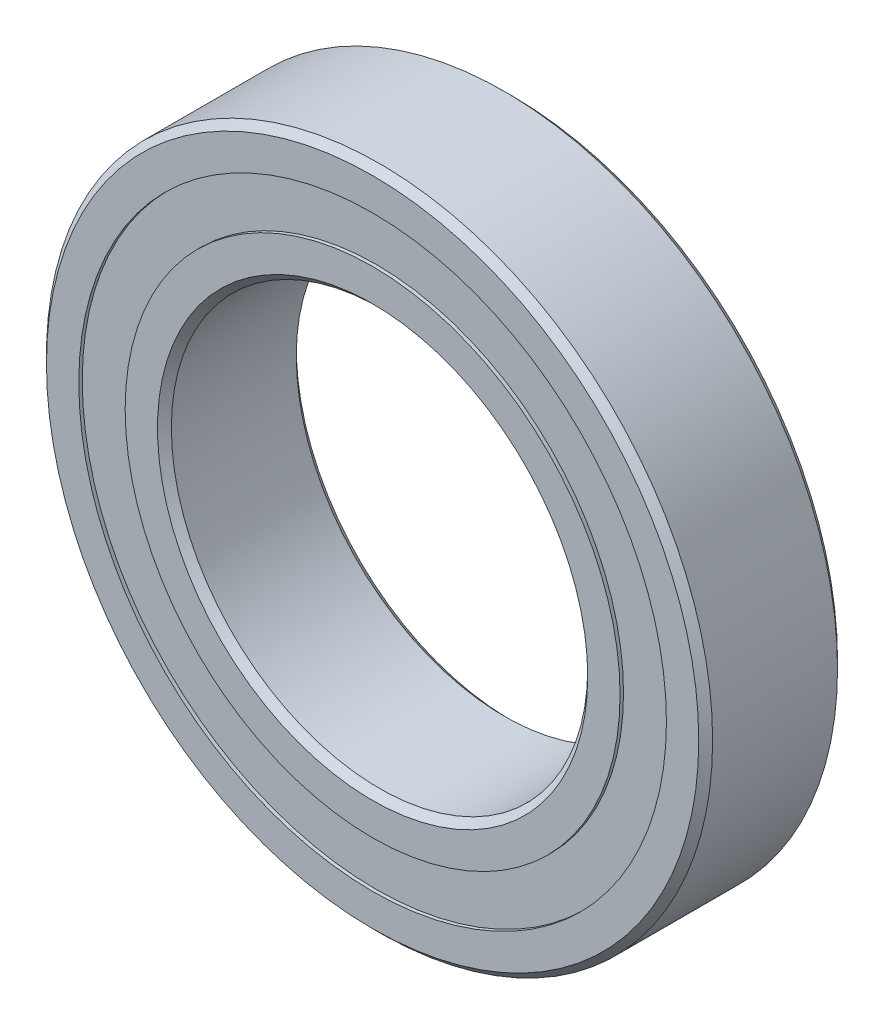
from build123d import *

# Parameters (mm, degrees)
CIRPATTERN1_COUNT = 12
SKETCH5_W         = 0.985011438
SKETCH5_H         = 1.67032967


with BuildPart() as part:
    # Sketch1 → Revolve1 (revolve)
    with BuildSketch(Plane(origin=(0, 0, 0), x_dir=(0, 0, -1), z_dir=(1, 0, 0))):
        with BuildLine():
            Line((2.25, 12), (-2.25, 12))
            Line((-2.25, 12), (-2.5, 11.75))
            Line((-2.5, 11.75), (-2.5, 10.585164835))
            Line((-2.5, 10.585164835), (-1.111111111, 10.585164835))
            ThreePointArc((-1.111111111, 10.585164835), (0, 11.139988562), (1.111111111, 10.585164835))
            Line((1.111111111, 10.585164835), (2.5, 10.585164835))
            Line((2.5, 10.585164835), (2.5, 11.75))
            Line((2.5, 11.75), (2.25, 12))
        make_face()
    revolve(axis=Axis((0, 0, 2.5), (0, 0, -1)))


with BuildPart() as body_2:
    # Sketch3 → Revolve3 (revolve)
    with BuildSketch(Plane(origin=(0, 0, 0), x_dir=(0, 0, -1), z_dir=(1, 0, 0))):
        with BuildLine():
            Line((-2.5, 8.914835165), (-1.111111111, 8.914835165))
            ThreePointArc((-1.111111111, 8.914835165), (0, 8.360011438), (1.111111111, 8.914835165))
            Line((1.111111111, 8.914835165), (2.5, 8.914835165))
            Line((2.5, 8.914835165), (2.5, 7.75))
            Line((2.5, 7.75), (2.25, 7.5))
            Line((2.25, 7.5), (-2.25, 7.5))
            Line((-2.25, 7.5), (-2.5, 7.75))
            Line((-2.5, 7.75), (-2.5, 8.914835165))
        make_face()
    revolve(axis=Axis((0, 0, 2.5), (0, 0, -1)))


with BuildPart() as body_3:
    # Sketch4 → Revolve4 (revolve)
    with BuildSketch(Plane(origin=(0, 0, 0), x_dir=(0, 0, -1), z_dir=(1, 0, 0))):
        with BuildLine():
            Line((-1.389988562, 9.75), (1.389988562, 9.75))
            ThreePointArc((1.389988562, 9.75), (0, 11.139988562), (-1.389988562, 9.75))
        make_face()
    revolve(axis=Axis((0, 9.75, 1.389988562), (0, 0, -1)))


with BuildPart() as cirpattern1_1:
    # CirPattern1: pattern copy
    add(body_3.part.rotate(Axis((0, 0, -2.5), (0, 0, 1)), 1 * 360 / CIRPATTERN1_COUNT))


with BuildPart() as cirpattern1_2:
    # CirPattern1: pattern copy
    add(body_3.part.rotate(Axis((0, 0, -2.5), (0, 0, 1)), 2 * 360 / CIRPATTERN1_COUNT))


with BuildPart() as cirpattern1_3:
    # CirPattern1: pattern copy
    add(body_3.part.rotate(Axis((0, 0, -2.5), (0, 0, 1)), 3 * 360 / CIRPATTERN1_COUNT))


with BuildPart() as cirpattern1_4:
    # CirPattern1: pattern copy
    add(body_3.part.rotate(Axis((0, 0, -2.5), (0, 0, 1)), 4 * 360 / CIRPATTERN1_COUNT))


with BuildPart() as cirpattern1_5:
    # CirPattern1: pattern copy
    add(body_3.part.rotate(Axis((0, 0, -2.5), (0, 0, 1)), 5 * 360 / CIRPATTERN1_COUNT))


with BuildPart() as cirpattern1_6:
    # CirPattern1: pattern copy
    add(body_3.part.rotate(Axis((0, 0, -2.5), (0, 0, 1)), 6 * 360 / CIRPATTERN1_COUNT))


with BuildPart() as cirpattern1_7:
    # CirPattern1: pattern copy
    add(body_3.part.rotate(Axis((0, 0, -2.5), (0, 0, 1)), 7 * 360 / CIRPATTERN1_COUNT))


with BuildPart() as cirpattern1_8:
    # CirPattern1: pattern copy
    add(body_3.part.rotate(Axis((0, 0, -2.5), (0, 0, 1)), 8 * 360 / CIRPATTERN1_COUNT))


with BuildPart() as cirpattern1_9:
    # CirPattern1: pattern copy
    add(body_3.part.rotate(Axis((0, 0, -2.5), (0, 0, 1)), 9 * 360 / CIRPATTERN1_COUNT))


with BuildPart() as cirpattern1_10:
    # CirPattern1: pattern copy
    add(body_3.part.rotate(Axis((0, 0, -2.5), (0, 0, 1)), 10 * 360 / CIRPATTERN1_COUNT))


with BuildPart() as cirpattern1_11:
    # CirPattern1: pattern copy
    add(body_3.part.rotate(Axis((0, 0, -2.5), (0, 0, 1)), 11 * 360 / CIRPATTERN1_COUNT))


with BuildPart() as body_15:
    # Sketch5 → Revolve5 (revolve)
    with BuildSketch(Plane(origin=(0, 0, 0), x_dir=(0, 0, -1), z_dir=(1, 0, 0))):
        with Locations((-1.882494281, 9.75)):
            Rectangle(SKETCH5_W, SKETCH5_H)
        with Locations((1.882494281, 9.75)):
            Rectangle(SKETCH5_W, SKETCH5_H)
    revolve(axis=Axis((0, 0, 2.5), (0, 0, -1)))


solid = Compound([part.part, body_2.part, body_3.part, cirpattern1_1.part, cirpattern1_2.part, cirpattern1_3.part, cirpattern1_4.part, cirpattern1_5.part, cirpattern1_6.part, cirpattern1_7.part, cirpattern1_8.part, cirpattern1_9.part, cirpattern1_10.part, cirpattern1_11.part, body_15.part])
